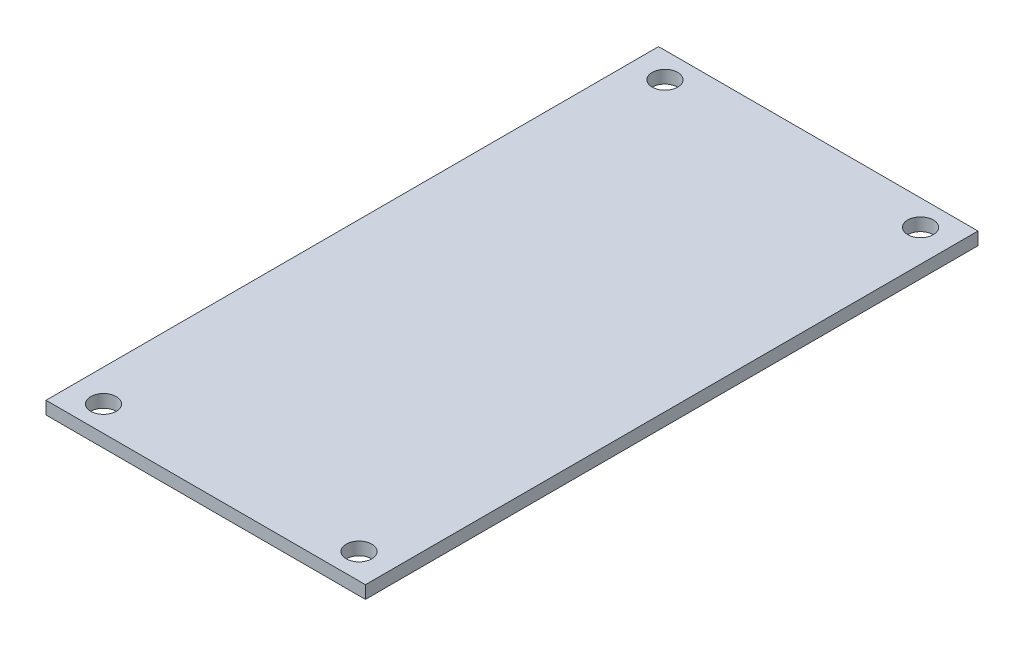
from build123d import *

# Parameters (mm, degrees)
SKETCH1_W           = 125
SKETCH1_H           = 239.7125
BOSS_EXTRUDE1_DEPTH = 5
CUT_EXTRUDE1_REACH  = 272.392
SKETCH2_R           = 5


with BuildPart() as part:
    # Sketch1 → Boss-Extrude1 (new body)
    with BuildSketch(Plane(origin=(0, 0, 0), x_dir=(1, 0, 0), z_dir=(0, 1, 0))):
        with Locations((62.5, -119.85625)):
            Rectangle(SKETCH1_W, SKETCH1_H)
    extrude(amount=BOSS_EXTRUDE1_DEPTH)

    # Sketch2 → Cut-Extrude1 (cut, up to next)
    with BuildSketch(Plane.XZ, mode=Mode.PRIVATE) as cut_extrude1_sk1:
        with Locations(Location((12.5, 229.7125, 0), (0, 0, 270))):
            Circle(SKETCH2_R)
    cut_extrude1_tool1 = extrude(cut_extrude1_sk1.sketch, amount=-CUT_EXTRUDE1_REACH, mode=Mode.PRIVATE) & part.part
    # Sketch2 → Cut-Extrude1 (cut, up to next)
    with BuildSketch(Plane.XZ, mode=Mode.PRIVATE) as cut_extrude1_sk2:
        with Locations(Location((112.5, 229.7125, 0), (0, 0, 270))):
            Circle(SKETCH2_R)
    cut_extrude1_tool2 = extrude(cut_extrude1_sk2.sketch, amount=-CUT_EXTRUDE1_REACH, mode=Mode.PRIVATE) & part.part
    # Sketch2 → Cut-Extrude1 (cut, up to next)
    with BuildSketch(Plane.XZ, mode=Mode.PRIVATE) as cut_extrude1_sk3:
        with Locations(Location((12.5, 10, 0), (0, 0, 270))):
            Circle(SKETCH2_R)
    cut_extrude1_tool3 = extrude(cut_extrude1_sk3.sketch, amount=-CUT_EXTRUDE1_REACH, mode=Mode.PRIVATE) & part.part
    # Sketch2 → Cut-Extrude1 (cut, up to next)
    with BuildSketch(Plane.XZ, mode=Mode.PRIVATE) as cut_extrude1_sk4:
        with Locations(Location((112.5, 10, 0), (0, 0, 270))):
            Circle(SKETCH2_R)
    cut_extrude1_tool4 = extrude(cut_extrude1_sk4.sketch, amount=-CUT_EXTRUDE1_REACH, mode=Mode.PRIVATE) & part.part
    add(cut_extrude1_tool1.solids().sort_by_distance((12.5, 0, 229.7125))[0], mode=Mode.SUBTRACT)
    add(cut_extrude1_tool2.solids().sort_by_distance((112.5, 0, 229.7125))[0], mode=Mode.SUBTRACT)
    add(cut_extrude1_tool3.solids().sort_by_distance((12.5, 0, 10))[0], mode=Mode.SUBTRACT)
    add(cut_extrude1_tool4.solids().sort_by_distance((112.5, 0, 10))[0], mode=Mode.SUBTRACT)


solid = part.part
